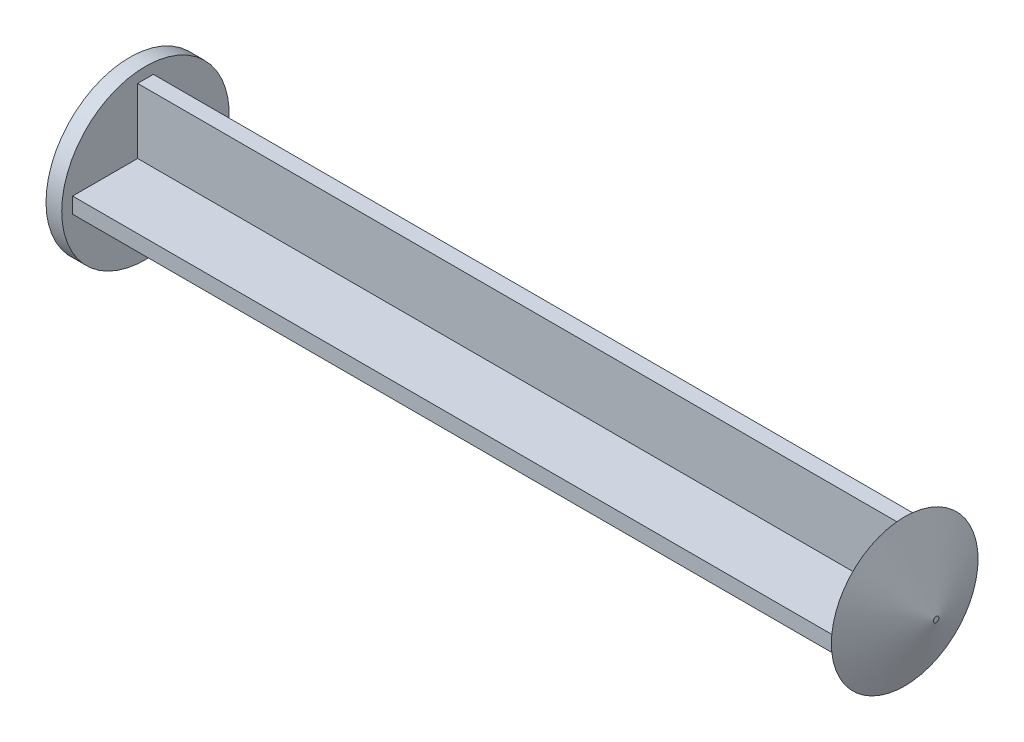
from build123d import *

# Parameters (mm, degrees)
SKETCH1_R           = 14
BOSS_EXTRUDE1_DEPTH = 6
BOSS_EXTRUDE1_TAPER = 66
BOSS_EXTRUDE2_DEPTH = 145
SKETCH3_R           = 16
BOSS_EXTRUDE3_DEPTH = 3


with BuildPart() as part:
    # Sketch1 → Boss-Extrude1 (new body)
    with BuildSketch(Plane(origin=(0, 0, 0), x_dir=(0, 0, -1), z_dir=(1, 0, 0))):
        Circle(SKETCH1_R)
    extrude(amount=BOSS_EXTRUDE1_DEPTH, taper=BOSS_EXTRUDE1_TAPER)

    # Sketch2 → Boss-Extrude2 (add)
    with BuildSketch(Plane.ZY):
        Polygon((1.5, -1.5), (1.5, -13.919410907), (-1.5, -13.919410907), (-1.5, -1.5), (-13.919410907, -1.5), (-13.919410907, 1.5), (-1.5, 1.5), (-1.5, 13.919410907), (1.5, 13.919410907), (1.5, 1.5), (13.919410907, 1.5), (13.919410907, -1.5), align=None)
    extrude(amount=BOSS_EXTRUDE2_DEPTH)

    # Sketch3 → Boss-Extrude3 (add)
    with BuildSketch(Plane.ZY.offset(145)):
        Circle(SKETCH3_R)
    extrude(amount=BOSS_EXTRUDE3_DEPTH)


solid = part.part
